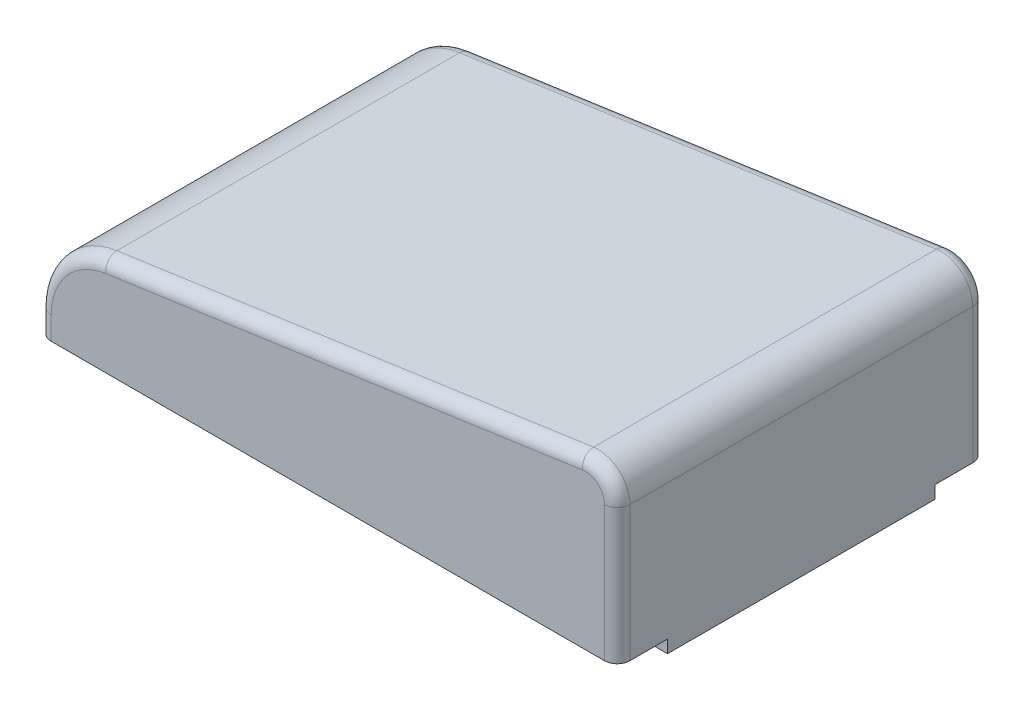
from build123d import *

# Parameters (mm, degrees)
BOSS_EXTRUDE1_DEPTH             = 25
CUT_EXTRUDE1_START              = -28.9
SKETCH2_OUTSIDE_W               = 112.526
SKETCH2_OUTSIDE_H               = 46.706
CUT_EXTRUDE1_DEPTH              = 28.9
SKETCH4_W                       = 91.745694177
SKETCH4_H                       = 28.9
BOSS_EXTRUDE2_DEPTH             = 2
FILLET4_R                       = 10
FILLET5_R                       = 12
FILLET3_R                       = 3
FILLET2_R                       = 5
FILLET1_R                       = 2
SKETCH5_W                       = 2
SKETCH5_H                       = 21
BOSS_EXTRUDE3_DEPTH             = 2
SKETCH10_W                      = 10
SKETCH10_H                      = 1.3
BOSS_EXTRUDE6_DEPTH             = 2
BOSS_EXTRUDE6_DIRECTION_2_REACH = 97.197
BOSS_EXTRUDE7_REACH             = 97.197
SKETCH11_R                      = 3.5
BOSS_EXTRUDE7_DIRECTION_2_DEPTH = 24.5
CHAMFER1_SIZE                   = 0.4
SKETCH12_R                      = 1.8
CUT_EXTRUDE2_DEPTH              = 6


with BuildPart() as part:
    # Sketch1 → Boss-Extrude1 (new body)
    with BuildSketch(Plane(origin=(0, 0, 0), x_dir=(1, 0, 0), z_dir=(0, 1, 0))):
        Polygon((-3.992584003, 28.9), (-3.992584003, 0), (-1.992584003, 0), (-1.992584003, 26.9), (84.827415997, 26.9), (84.827415997, 0), (86.827415997, 0), (86.827415997, 28.9), align=None)
    extrude(amount=BOSS_EXTRUDE1_DEPTH)

    # Sketch2 outside → Cut-Extrude1 (cut)
    with BuildSketch(Plane.XY.offset(CUT_EXTRUDE1_START)):
        with Locations((41.417, 12.5)):
            Rectangle(SKETCH2_OUTSIDE_W, SKETCH2_OUTSIDE_H)
        Polygon((-3.992584003, 0), (86.827415997, 0), (86.827415997, 25), (-3.992584003, 12), align=None, mode=Mode.SUBTRACT)
    extrude(amount=CUT_EXTRUDE1_DEPTH, mode=Mode.SUBTRACT)

    # Sketch4 → Boss-Extrude2 (add, along a direction that is not the sketch's normal)
    with BuildSketch(Plane(origin=(-1.763358246, 12.319091993, 0), x_dir=(0.9899102166570531, 0.14169602308458154, 0), z_dir=(-0.1416960230845815, 0.989910216657053, 0))):
        with Locations((43.620899669, 14.45)):
            Rectangle(SKETCH4_W, SKETCH4_H)
    extrude(amount=BOSS_EXTRUDE2_DEPTH, dir=(0, 1, 0))

    # Fillet4
    fillet4_edges = [part.edges().sort_by_distance(p)[0] for p in [
        (-1.992584003, 12.286280555, -13.45),
    ]]
    fillet(fillet4_edges, radius=FILLET4_R)

    # Fillet5
    fillet5_edges = [part.edges().sort_by_distance(p)[0] for p in [
        (-3.992584003, 14, -14.45),
    ]]
    fillet(fillet5_edges, radius=FILLET5_R)

    # Fillet3
    fillet3_edges = [part.edges().sort_by_distance(p)[0] for p in [
        (84.827415997, 24.713719445, -13.45),
    ]]
    fillet(fillet3_edges, radius=FILLET3_R)

    # Fillet2
    fillet2_edges = [part.edges().sort_by_distance(p)[0] for p in [
        (86.827415997, 27, -14.45),
    ]]
    fillet(fillet2_edges, radius=FILLET2_R)

    # Fillet1
    fillet1_edges = [part.edges().sort_by_distance(p)[0] for p in [
        (-3.992584003, 1.797685917, -28.9),
        (-1.059122133, 11.456535, -28.9),
        (43.7129998, 20.828590503, -28.9),
        (86.827415997, 10.616667745, -28.9),
        (85.102900649, 25.01105971, -28.9),
    ]]
    fillet(fillet1_edges, radius=FILLET1_R)

    # Sketch5 → Boss-Extrude3 (add)
    with BuildSketch(Plane(origin=(0, 0, 0), x_dir=(1, 0, 0), z_dir=(0, 1, 0))):
        with Locations((-2.992584003, 10.5)):
            Rectangle(SKETCH5_W, SKETCH5_H)
        with Locations((85.827415997, 10.5)):
            Rectangle(SKETCH5_W, SKETCH5_H)
    extrude(amount=-BOSS_EXTRUDE3_DEPTH)

    # Sketch10 → Boss-Extrude6 (add)
    with BuildSketch(Plane(origin=(0, 0, 0), x_dir=(1, 0, 0), z_dir=(0, 1, 0))):
        with Locations((3.007415997, 26.05)):
            Rectangle(SKETCH10_W, SKETCH10_H)
    extrude(amount=-BOSS_EXTRUDE6_DEPTH)

    # Sketch10 → Boss-Extrude6 direction 2 (add, up to next)
    with BuildSketch(Plane(origin=(0, 0, 0), x_dir=(1, 0, 0), z_dir=(0, 1, 0)), mode=Mode.PRIVATE) as boss_extrude6_direction_2_sk1:
        with Locations((3.007415997, 26.05)):
            Rectangle(SKETCH10_W, SKETCH10_H)
    boss_extrude6_direction_2_tool1 = extrude(boss_extrude6_direction_2_sk1.sketch, amount=BOSS_EXTRUDE6_DIRECTION_2_REACH, mode=Mode.PRIVATE) - part.part
    add(boss_extrude6_direction_2_tool1.solids().sort_by_distance((3.007416, 0, -26.05))[0])

    # Mirror6: part across plane


with BuildPart() as part_1:
    add(part.part)
    add(part.part.mirror(Plane.XY))

    # Sketch11 → Boss-Extrude7 (add, up to next)
    with BuildSketch(Plane(origin=(0, 0, 0), x_dir=(1, 0, 0), z_dir=(0, 1, 0)), mode=Mode.PRIVATE) as boss_extrude7_sk1:
        with Locations(Location((7.007415997, 0, 0), (0, 0, 270))):
            Circle(SKETCH11_R)
    boss_extrude7_tool1 = extrude(boss_extrude7_sk1.sketch, amount=BOSS_EXTRUDE7_REACH, mode=Mode.PRIVATE) - part_1.part
    add(boss_extrude7_tool1.solids().sort_by_distance((7.007416, 0, 0))[0])

    # Sketch11 → Boss-Extrude7 direction 2 (add)
    with BuildSketch(Plane(origin=(0, 0, 0), x_dir=(1, 0, 0), z_dir=(0, 1, 0))):
        with Locations(Location((7.007415997, 0, 0), (0, 0, 270))):
            Circle(SKETCH11_R)
    extrude(amount=-BOSS_EXTRUDE7_DIRECTION_2_DEPTH)

    # Chamfer1
    chamfer1_edges = [part_1.edges().sort_by_distance(p)[0] for p in [
        (7.007415997, -24.5, -3.5),
    ]]
    chamfer(chamfer1_edges, length=CHAMFER1_SIZE)

    # Sketch12 → Cut-Extrude2 (cut)
    with BuildSketch(Plane.XZ.offset(24.5)):
        with Locations(Location((7.007415997, 0, 0), (0, 0, 270))):
            Circle(SKETCH12_R)
    extrude(amount=-CUT_EXTRUDE2_DEPTH, mode=Mode.SUBTRACT)


solid = part_1.part
